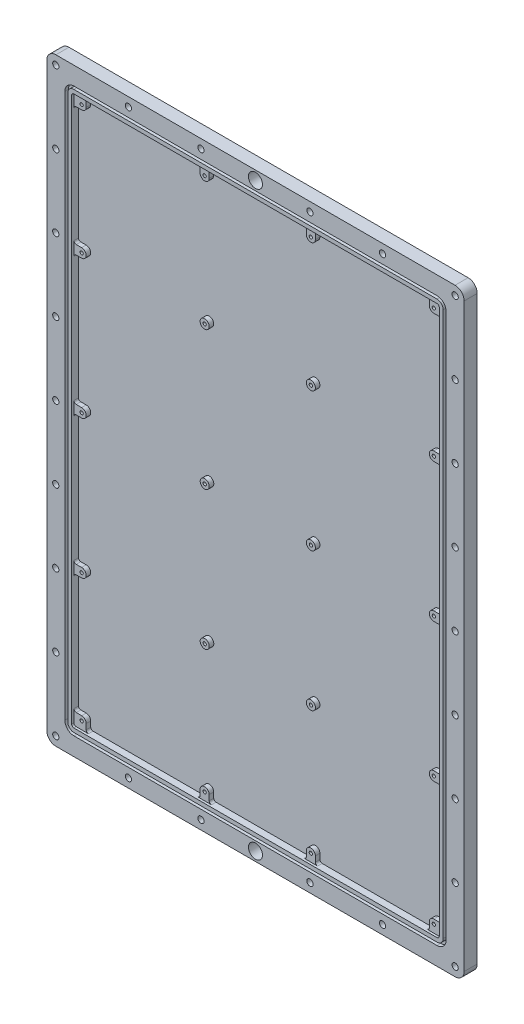
from build123d import *
from OCP.BRepFilletAPI import BRepFilletAPI_MakeChamfer

# Parameters (mm, degrees)
SKETCH1_W           = 291.973
SKETCH1_H           = 418.973
BOSS_EXTRUDE1_DEPTH = 9.144
SKETCH4_R           = 2.1844
CUT_EXTRUDE1_DEPTH  = 511.754559641
CUT_EXTRUDE2_DEPTH  = 2.54
LPATTERN4_COUNT     = 8
LPATTERN4_PITCH     = 50.8
CUT_EXTRUDE3_DEPTH  = 4.7625
SKETCH7_R           = 1.1303
CUT_EXTRUDE4_DEPTH  = 1.5875
FILLET1_R           = 6.35
SKETCH10_R          = 2.1844
SKETCH10_R_2        = 4.9022
CUT_EXTRUDE7_DEPTH  = 511.754559641
LPATTERN5_COUNT     = 2
LPATTERN5_PITCH     = 406.4
CHAMFER1_SIZE       = 2.54
CHAMFER1_SIZE2      = 2.207988314
BOSS_EXTRUDE4_START = 3.175
SKETCH11_R          = 3.175
SKETCH11_R_2        = 1.1303
BOSS_EXTRUDE4_DEPTH = 3.175
FILLET2_R           = 1.5875


with BuildPart() as part:
    # Sketch1 → Boss-Extrude1 (new body)
    with BuildSketch(Plane.XY):
        with Locations((145.9865, 209.4865)):
            Rectangle(SKETCH1_W, SKETCH1_H)
    extrude(amount=BOSS_EXTRUDE1_DEPTH)

    # Sketch4 → Cut-Extrude1 (cut, through all)
    with BuildSketch(Plane.XY.offset(9.144)):
        with Locations((6.2865, 6.2865)):
            Circle(SKETCH4_R)
        with Locations((6.2865, 412.6865)):
            Circle(SKETCH4_R)
        with Locations((285.6865, 412.6865)):
            Circle(SKETCH4_R)
        with Locations((285.6865, 6.2865)):
            Circle(SKETCH4_R)
    cut_extrude1 = extrude(amount=-CUT_EXTRUDE1_DEPTH, mode=Mode.SUBTRACT)

    # Sketch5 → Cut-Extrude2 (cut)
    with BuildSketch(Plane.XY.offset(9.144)):
        with BuildLine():
            Line((18.9865, 406.3365), (272.9865, 406.3365))
            ThreePointArc((272.9865, 406.3365), (277.476628061, 404.476628061), (279.3365, 399.9865))
            Line((279.3365, 399.9865), (279.3365, 18.9865))
            ThreePointArc((279.3365, 18.9865), (277.476628061, 14.496371939), (272.9865, 12.6365))
            Line((272.9865, 12.6365), (18.9865, 12.6365))
            ThreePointArc((18.9865, 12.6365), (14.496371939, 14.496371939), (12.6365, 18.9865))
            Line((12.6365, 18.9865), (12.6365, 399.9865))
            ThreePointArc((12.6365, 399.9865), (14.496371939, 404.476628061), (18.9865, 406.3365))
        make_face()
        with BuildLine():
            ThreePointArc((272.9865, 14.6685), (276.039787081, 15.933212919), (277.3045, 18.9865))
            Line((277.3045, 18.9865), (277.3045, 399.9865))
            ThreePointArc((277.3045, 399.9865), (276.039787081, 403.039787081), (272.9865, 404.3045))
            Line((272.9865, 404.3045), (18.9865, 404.3045))
            ThreePointArc((18.9865, 404.3045), (15.933212919, 403.039787081), (14.6685, 399.9865))
            Line((14.6685, 399.9865), (14.6685, 18.9865))
            ThreePointArc((14.6685, 18.9865), (15.933212919, 15.933212919), (18.9865, 14.6685))
            Line((18.9865, 14.6685), (272.9865, 14.6685))
        make_face(mode=Mode.SUBTRACT)
    extrude(amount=-CUT_EXTRUDE2_DEPTH, mode=Mode.SUBTRACT)

    # LPattern4: Cut-Extrude1 ×8
    with Locations(*[(0, -i * LPATTERN4_PITCH, 0) for i in range(1, LPATTERN4_COUNT)]):
        add(cut_extrude1, mode=Mode.SUBTRACT)

    # Sketch6 → Cut-Extrude3 (cut)
    with BuildSketch(Plane.XY.offset(9.144)):
        with BuildLine():
            Line((274.574, 18.9865), (274.574, 399.9865))
            ThreePointArc((274.574, 399.9865), (274.109032015, 401.109032015), (272.9865, 401.574))
            Line((272.9865, 401.574), (18.9865, 401.574))
            ThreePointArc((18.9865, 401.574), (17.863967985, 401.109032015), (17.399, 399.9865))
            Line((17.399, 399.9865), (17.399, 18.9865))
            ThreePointArc((17.399, 18.9865), (17.863967985, 17.863967985), (18.9865, 17.399))
            Line((18.9865, 17.399), (272.9865, 17.399))
            ThreePointArc((272.9865, 17.399), (274.109032015, 17.863967985), (274.574, 18.9865))
        make_face()
    extrude(amount=-CUT_EXTRUDE3_DEPTH, mode=Mode.SUBTRACT)

    # Sketch7 → Cut-Extrude4 (cut)
    with BuildSketch(Plane.XY.offset(4.3815)):
        with Locations((22.7965, 396.1765)):
            Circle(SKETCH7_R)
        with Locations((269.1765, 396.1765)):
            Circle(SKETCH7_R)
        with Locations((22.7965, 22.7965)):
            Circle(SKETCH7_R)
        with Locations((108.8517, 22.7965)):
            Circle(SKETCH7_R)
        with Locations((108.8517, 396.1765)):
            Circle(SKETCH7_R)
        with Locations((183.1213, 396.1765)):
            Circle(SKETCH7_R)
        with Locations((183.1213, 22.7965)):
            Circle(SKETCH7_R)
        with Locations((269.1765, 22.7965)):
            Circle(SKETCH7_R)
        with Locations((269.1765, 112.6109)):
            Circle(SKETCH7_R)
        with Locations((108.8898, 112.6109)):
            Circle(SKETCH7_R)
        with Locations((183.1594, 112.6109)):
            Circle(SKETCH7_R)
        with Locations((22.7965, 112.6109)):
            Circle(SKETCH7_R)
        with Locations((269.1765, 209.4865)):
            Circle(SKETCH7_R)
        with Locations((108.8898, 209.4865)):
            Circle(SKETCH7_R)
        with Locations((183.1594, 209.4865)):
            Circle(SKETCH7_R)
        with Locations((22.7965, 209.4865)):
            Circle(SKETCH7_R)
        with Locations((269.1765, 306.3621)):
            Circle(SKETCH7_R)
        with Locations((108.8517, 306.3621)):
            Circle(SKETCH7_R)
        with Locations((183.1213, 306.3621)):
            Circle(SKETCH7_R)
        with Locations((22.7965, 306.3621)):
            Circle(SKETCH7_R)
    extrude(amount=-CUT_EXTRUDE4_DEPTH, mode=Mode.SUBTRACT)

    # Fillet1
    fillet1_edges = [part.edges().sort_by_distance(p)[0] for p in [
        (0, 418.973, 4.572),
        (291.973, 418.973, 4.572),
        (291.973, 0, 4.572),
        (0, 0, 4.572),
    ]]
    fillet(fillet1_edges, radius=FILLET1_R)

    # Sketch10 → Cut-Extrude7 (cut, through all)
    with BuildSketch(Plane(origin=(0, 0, 0), x_dir=(-1, 0, 0), z_dir=(0, 0, -1))):
        with Locations((-234.8865, 412.6865)):
            Circle(SKETCH10_R)
        with Locations((-184.0865, 412.6865)):
            Circle(SKETCH10_R)
        with Locations((-107.8865, 412.6865)):
            Circle(SKETCH10_R)
        with Locations((-57.0865, 412.6865)):
            Circle(SKETCH10_R)
        with Locations((-145.9865, 412.6865)):
            Circle(SKETCH10_R_2)
    cut_extrude7 = extrude(amount=-CUT_EXTRUDE7_DEPTH, mode=Mode.SUBTRACT)

    # LPattern5: Cut-Extrude7 ×2
    with Locations(*[(0, -i * LPATTERN5_PITCH, 0) for i in range(1, LPATTERN5_COUNT)]):
        add(cut_extrude7, mode=Mode.SUBTRACT)

    # Chamfer1: one chamfer whose edges measure the first distance from different faces: ONE call of the kernel's chamfer builder (chamfer() names one face for all edges)
    chamfer1_edges_1 = [part.edges().sort_by_distance(p)[0] for p in [
        (4.1021, 6.2865, 0),
    ]]
    chamfer1_side_1 = [part.faces().sort_by_distance(p)[0] for p in [
        (4.1021, 6.2865, 4.572),
    ]]
    chamfer1_edges_2 = [part.edges().sort_by_distance(p)[0] for p in [
        (4.1021, 412.6865, 0),
    ]]
    chamfer1_side_2 = [part.faces().sort_by_distance(p)[0] for p in [
        (4.1021, 412.6865, 4.572),
    ]]
    chamfer1_edges_3 = [part.edges().sort_by_distance(p)[0] for p in [
        (283.5021, 412.6865, 0),
    ]]
    chamfer1_side_3 = [part.faces().sort_by_distance(p)[0] for p in [
        (283.5021, 412.6865, 4.572),
    ]]
    chamfer1_edges_4 = [part.edges().sort_by_distance(p)[0] for p in [
        (237.0709, 412.6865, 0),
        (186.2709, 412.6865, 0),
        (110.0709, 412.6865, 0),
        (59.2709, 412.6865, 0),
        (237.0709, 6.2865, 0),
        (186.2709, 6.2865, 0),
        (110.0709, 6.2865, 0),
        (59.2709, 6.2865, 0),
    ]]
    chamfer1_side_4 = [part.faces().sort_by_distance(p)[0] for p in [
        (145.9865, 209.4865, 0),
    ]]
    chamfer1_edges_5 = [part.edges().sort_by_distance(p)[0] for p in [
        (283.5021, 6.2865, 0),
    ]]
    chamfer1_side_5 = [part.faces().sort_by_distance(p)[0] for p in [
        (283.5021, 6.2865, 4.572),
    ]]
    chamfer1_edges_6 = [part.edges().sort_by_distance(p)[0] for p in [
        (4.1021, 361.8865, 0),
    ]]
    chamfer1_side_6 = [part.faces().sort_by_distance(p)[0] for p in [
        (4.1021, 361.8865, 4.572),
    ]]
    chamfer1_edges_7 = [part.edges().sort_by_distance(p)[0] for p in [
        (283.5021, 361.8865, 0),
    ]]
    chamfer1_side_7 = [part.faces().sort_by_distance(p)[0] for p in [
        (283.5021, 361.8865, 4.572),
    ]]
    chamfer1_edges_8 = [part.edges().sort_by_distance(p)[0] for p in [
        (4.1021, 311.0865, 0),
    ]]
    chamfer1_side_8 = [part.faces().sort_by_distance(p)[0] for p in [
        (4.1021, 311.0865, 4.572),
    ]]
    chamfer1_edges_9 = [part.edges().sort_by_distance(p)[0] for p in [
        (283.5021, 311.0865, 0),
    ]]
    chamfer1_side_9 = [part.faces().sort_by_distance(p)[0] for p in [
        (283.5021, 311.0865, 4.572),
    ]]
    chamfer1_edges_10 = [part.edges().sort_by_distance(p)[0] for p in [
        (4.1021, 260.2865, 0),
    ]]
    chamfer1_side_10 = [part.faces().sort_by_distance(p)[0] for p in [
        (4.1021, 260.2865, 4.572),
    ]]
    chamfer1_edges_11 = [part.edges().sort_by_distance(p)[0] for p in [
        (283.5021, 260.2865, 0),
    ]]
    chamfer1_side_11 = [part.faces().sort_by_distance(p)[0] for p in [
        (283.5021, 260.2865, 4.572),
    ]]
    chamfer1_edges_12 = [part.edges().sort_by_distance(p)[0] for p in [
        (4.1021, 209.4865, 0),
    ]]
    chamfer1_side_12 = [part.faces().sort_by_distance(p)[0] for p in [
        (4.1021, 209.4865, 4.572),
    ]]
    chamfer1_edges_13 = [part.edges().sort_by_distance(p)[0] for p in [
        (283.5021, 209.4865, 0),
    ]]
    chamfer1_side_13 = [part.faces().sort_by_distance(p)[0] for p in [
        (283.5021, 209.4865, 4.572),
    ]]
    chamfer1_edges_14 = [part.edges().sort_by_distance(p)[0] for p in [
        (4.1021, 158.6865, 0),
    ]]
    chamfer1_side_14 = [part.faces().sort_by_distance(p)[0] for p in [
        (4.1021, 158.6865, 4.572),
    ]]
    chamfer1_edges_15 = [part.edges().sort_by_distance(p)[0] for p in [
        (283.5021, 158.6865, 0),
    ]]
    chamfer1_side_15 = [part.faces().sort_by_distance(p)[0] for p in [
        (283.5021, 158.6865, 4.572),
    ]]
    chamfer1_edges_16 = [part.edges().sort_by_distance(p)[0] for p in [
        (4.1021, 107.8865, 0),
    ]]
    chamfer1_side_16 = [part.faces().sort_by_distance(p)[0] for p in [
        (4.1021, 107.8865, 4.572),
    ]]
    chamfer1_edges_17 = [part.edges().sort_by_distance(p)[0] for p in [
        (283.5021, 107.8865, 0),
    ]]
    chamfer1_side_17 = [part.faces().sort_by_distance(p)[0] for p in [
        (283.5021, 107.8865, 4.572),
    ]]
    chamfer1_edges_18 = [part.edges().sort_by_distance(p)[0] for p in [
        (4.1021, 57.0865, 0),
    ]]
    chamfer1_side_18 = [part.faces().sort_by_distance(p)[0] for p in [
        (4.1021, 57.0865, 4.572),
    ]]
    chamfer1_edges_19 = [part.edges().sort_by_distance(p)[0] for p in [
        (283.5021, 57.0865, 0),
    ]]
    chamfer1_side_19 = [part.faces().sort_by_distance(p)[0] for p in [
        (283.5021, 57.0865, 4.572),
    ]]
    chamfer1 = BRepFilletAPI_MakeChamfer(part.part.solid().wrapped)
    for e in chamfer1_edges_1:
        chamfer1.Add(CHAMFER1_SIZE, CHAMFER1_SIZE2, e.wrapped, chamfer1_side_1[0].wrapped)  # the first distance lies on this face
    for e in chamfer1_edges_2:
        chamfer1.Add(CHAMFER1_SIZE, CHAMFER1_SIZE2, e.wrapped, chamfer1_side_2[0].wrapped)  # the first distance lies on this face
    for e in chamfer1_edges_3:
        chamfer1.Add(CHAMFER1_SIZE, CHAMFER1_SIZE2, e.wrapped, chamfer1_side_3[0].wrapped)  # the first distance lies on this face
    for e in chamfer1_edges_4:
        chamfer1.Add(CHAMFER1_SIZE, CHAMFER1_SIZE2, e.wrapped, chamfer1_side_4[0].wrapped)  # the first distance lies on this face
    for e in chamfer1_edges_5:
        chamfer1.Add(CHAMFER1_SIZE, CHAMFER1_SIZE2, e.wrapped, chamfer1_side_5[0].wrapped)  # the first distance lies on this face
    for e in chamfer1_edges_6:
        chamfer1.Add(CHAMFER1_SIZE, CHAMFER1_SIZE2, e.wrapped, chamfer1_side_6[0].wrapped)  # the first distance lies on this face
    for e in chamfer1_edges_7:
        chamfer1.Add(CHAMFER1_SIZE, CHAMFER1_SIZE2, e.wrapped, chamfer1_side_7[0].wrapped)  # the first distance lies on this face
    for e in chamfer1_edges_8:
        chamfer1.Add(CHAMFER1_SIZE, CHAMFER1_SIZE2, e.wrapped, chamfer1_side_8[0].wrapped)  # the first distance lies on this face
    for e in chamfer1_edges_9:
        chamfer1.Add(CHAMFER1_SIZE, CHAMFER1_SIZE2, e.wrapped, chamfer1_side_9[0].wrapped)  # the first distance lies on this face
    for e in chamfer1_edges_10:
        chamfer1.Add(CHAMFER1_SIZE, CHAMFER1_SIZE2, e.wrapped, chamfer1_side_10[0].wrapped)  # the first distance lies on this face
    for e in chamfer1_edges_11:
        chamfer1.Add(CHAMFER1_SIZE, CHAMFER1_SIZE2, e.wrapped, chamfer1_side_11[0].wrapped)  # the first distance lies on this face
    for e in chamfer1_edges_12:
        chamfer1.Add(CHAMFER1_SIZE, CHAMFER1_SIZE2, e.wrapped, chamfer1_side_12[0].wrapped)  # the first distance lies on this face
    for e in chamfer1_edges_13:
        chamfer1.Add(CHAMFER1_SIZE, CHAMFER1_SIZE2, e.wrapped, chamfer1_side_13[0].wrapped)  # the first distance lies on this face
    for e in chamfer1_edges_14:
        chamfer1.Add(CHAMFER1_SIZE, CHAMFER1_SIZE2, e.wrapped, chamfer1_side_14[0].wrapped)  # the first distance lies on this face
    for e in chamfer1_edges_15:
        chamfer1.Add(CHAMFER1_SIZE, CHAMFER1_SIZE2, e.wrapped, chamfer1_side_15[0].wrapped)  # the first distance lies on this face
    for e in chamfer1_edges_16:
        chamfer1.Add(CHAMFER1_SIZE, CHAMFER1_SIZE2, e.wrapped, chamfer1_side_16[0].wrapped)  # the first distance lies on this face
    for e in chamfer1_edges_17:
        chamfer1.Add(CHAMFER1_SIZE, CHAMFER1_SIZE2, e.wrapped, chamfer1_side_17[0].wrapped)  # the first distance lies on this face
    for e in chamfer1_edges_18:
        chamfer1.Add(CHAMFER1_SIZE, CHAMFER1_SIZE2, e.wrapped, chamfer1_side_18[0].wrapped)  # the first distance lies on this face
    for e in chamfer1_edges_19:
        chamfer1.Add(CHAMFER1_SIZE, CHAMFER1_SIZE2, e.wrapped, chamfer1_side_19[0].wrapped)  # the first distance lies on this face
    add(Compound.cast(chamfer1.Shape()), mode=Mode.REPLACE)

    # Sketch11 → Boss-Extrude4 (add)
    # profile 1 of 34: a face of its own
    with BuildSketch(Plane.XY.offset(4.3815).offset(BOSS_EXTRUDE4_START)):
        with BuildLine():
            Line((17.399, 399.9865), (17.399, 393.0015))
            Line((17.399, 393.0015), (22.7965, 393.0015))
            ThreePointArc((22.7965, 393.0015), (20.55143597, 398.42156403), (25.9715, 396.1765))
            Line((25.9715, 396.1765), (25.9715, 401.574))
            Line((25.9715, 401.574), (18.9865, 401.574))
            ThreePointArc((18.9865, 401.574), (17.863967985, 401.109032015), (17.399, 399.9865))
        make_face()
    # profile 2 of 34: a face of its own
    with BuildSketch(Plane.XY.offset(4.3815).offset(BOSS_EXTRUDE4_START)):
        with Locations((22.7965, 396.1765)):
            Circle(SKETCH11_R)
        with Locations((22.7965, 396.1765)):
            Circle(SKETCH11_R_2, mode=Mode.SUBTRACT)
    # profile 3 of 34: a face of its own
    with BuildSketch(Plane.XY.offset(4.3815).offset(BOSS_EXTRUDE4_START)):
        with Locations((108.8517, 396.1765)):
            Circle(SKETCH11_R)
        with Locations((108.8517, 396.1765)):
            Circle(SKETCH11_R_2, mode=Mode.SUBTRACT)
    # profile 4 of 34: a face of its own
    with BuildSketch(Plane.XY.offset(4.3815).offset(BOSS_EXTRUDE4_START)):
        with BuildLine():
            Line((112.0267, 401.574), (105.6767, 401.574))
            Line((105.6767, 401.574), (105.6767, 396.1765))
            ThreePointArc((105.6767, 396.1765), (108.8517, 399.3515), (112.0267, 396.1765))
            Line((112.0267, 396.1765), (112.0267, 401.574))
        make_face()
    # profile 5 of 34: a face of its own
    with BuildSketch(Plane.XY.offset(4.3815).offset(BOSS_EXTRUDE4_START)):
        with Locations((183.1213, 396.1765)):
            Circle(SKETCH11_R)
        with Locations((183.1213, 396.1765)):
            Circle(SKETCH11_R_2, mode=Mode.SUBTRACT)
    # profile 6 of 34: a face of its own
    with BuildSketch(Plane.XY.offset(4.3815).offset(BOSS_EXTRUDE4_START)):
        with BuildLine():
            Line((186.2963, 401.574), (179.9463, 401.574))
            Line((179.9463, 401.574), (179.9463, 396.1765))
            ThreePointArc((179.9463, 396.1765), (183.1213, 399.3515), (186.2963, 396.1765))
            Line((186.2963, 396.1765), (186.2963, 401.574))
        make_face()
    # profile 7 of 34: a face of its own
    with BuildSketch(Plane.XY.offset(4.3815).offset(BOSS_EXTRUDE4_START)):
        with Locations((269.1765, 396.1765)):
            Circle(SKETCH11_R)
        with Locations((269.1765, 396.1765)):
            Circle(SKETCH11_R_2, mode=Mode.SUBTRACT)
    # profile 8 of 34: a face of its own
    with BuildSketch(Plane.XY.offset(4.3815).offset(BOSS_EXTRUDE4_START)):
        with BuildLine():
            Line((272.9865, 401.574), (266.0015, 401.574))
            Line((266.0015, 401.574), (266.0015, 396.1765))
            ThreePointArc((266.0015, 396.1765), (269.1765, 399.3515), (272.3515, 396.1765))
            ThreePointArc((272.3515, 396.1765), (271.42156403, 393.93143597), (269.1765, 393.0015))
            Line((269.1765, 393.0015), (274.574, 393.0015))
            Line((274.574, 393.0015), (274.574, 399.9865))
            ThreePointArc((274.574, 399.9865), (274.109032015, 401.109032015), (272.9865, 401.574))
        make_face()
    # profile 9 of 34: a face of its own
    with BuildSketch(Plane.XY.offset(4.3815).offset(BOSS_EXTRUDE4_START)):
        with Locations((269.1765, 306.3621)):
            Circle(SKETCH11_R)
        with Locations((269.1765, 306.3621)):
            Circle(SKETCH11_R_2, mode=Mode.SUBTRACT)
    # profile 10 of 34: a face of its own
    with BuildSketch(Plane.XY.offset(4.3815).offset(BOSS_EXTRUDE4_START)):
        with BuildLine():
            Line((269.1765, 303.1871), (274.574, 303.1871))
            Line((274.574, 303.1871), (274.574, 309.5371))
            Line((274.574, 309.5371), (269.1765, 309.5371))
            ThreePointArc((269.1765, 309.5371), (271.42156403, 308.60716403), (272.3515, 306.3621))
            ThreePointArc((272.3515, 306.3621), (271.42156403, 304.11703597), (269.1765, 303.1871))
        make_face()
    # profile 11 of 34: a face of its own
    with BuildSketch(Plane.XY.offset(4.3815).offset(BOSS_EXTRUDE4_START)):
        with Locations((269.1765, 209.4865)):
            Circle(SKETCH11_R)
        with Locations((269.1765, 209.4865)):
            Circle(SKETCH11_R_2, mode=Mode.SUBTRACT)
    # profile 12 of 34: a face of its own
    with BuildSketch(Plane.XY.offset(4.3815).offset(BOSS_EXTRUDE4_START)):
        with BuildLine():
            Line((269.1765, 206.3115), (274.574, 206.3115))
            Line((274.574, 206.3115), (274.574, 212.6615))
            Line((274.574, 212.6615), (269.1765, 212.6615))
            ThreePointArc((269.1765, 212.6615), (271.42156403, 211.73156403), (272.3515, 209.4865))
            ThreePointArc((272.3515, 209.4865), (271.42156403, 207.24143597), (269.1765, 206.3115))
        make_face()
    # profile 13 of 34: a face of its own
    with BuildSketch(Plane.XY.offset(4.3815).offset(BOSS_EXTRUDE4_START)):
        with Locations((269.1765, 112.6109)):
            Circle(SKETCH11_R)
        with Locations((269.1765, 112.6109)):
            Circle(SKETCH11_R_2, mode=Mode.SUBTRACT)
    # profile 14 of 34: a face of its own
    with BuildSketch(Plane.XY.offset(4.3815).offset(BOSS_EXTRUDE4_START)):
        with BuildLine():
            Line((269.1765, 109.4359), (274.574, 109.4359))
            Line((274.574, 109.4359), (274.574, 115.7859))
            Line((274.574, 115.7859), (269.1765, 115.7859))
            ThreePointArc((269.1765, 115.7859), (271.42156403, 114.85596403), (272.3515, 112.6109))
            ThreePointArc((272.3515, 112.6109), (271.42156403, 110.36583597), (269.1765, 109.4359))
        make_face()
    # profile 15 of 34: a face of its own
    with BuildSketch(Plane.XY.offset(4.3815).offset(BOSS_EXTRUDE4_START)):
        with Locations((269.1765, 22.7965)):
            Circle(SKETCH11_R)
        with Locations((269.1765, 22.7965)):
            Circle(SKETCH11_R_2, mode=Mode.SUBTRACT)
    # profile 16 of 34: a face of its own
    with BuildSketch(Plane.XY.offset(4.3815).offset(BOSS_EXTRUDE4_START)):
        with BuildLine():
            Line((266.0015, 22.7965), (266.0015, 17.399))
            Line((266.0015, 17.399), (272.9865, 17.399))
            ThreePointArc((272.9865, 17.399), (274.109032015, 17.863967985), (274.574, 18.9865))
            Line((274.574, 18.9865), (274.574, 25.9715))
            Line((274.574, 25.9715), (269.1765, 25.9715))
            ThreePointArc((269.1765, 25.9715), (271.42156403, 25.04156403), (272.3515, 22.7965))
            ThreePointArc((272.3515, 22.7965), (269.1765, 19.6215), (266.0015, 22.7965))
        make_face()
    # profile 17 of 34: a face of its own
    with BuildSketch(Plane.XY.offset(4.3815).offset(BOSS_EXTRUDE4_START)):
        with Locations((183.1213, 22.7965)):
            Circle(SKETCH11_R)
        with Locations((183.1213, 22.7965)):
            Circle(SKETCH11_R_2, mode=Mode.SUBTRACT)
    # profile 18 of 34: a face of its own
    with BuildSketch(Plane.XY.offset(4.3815).offset(BOSS_EXTRUDE4_START)):
        with BuildLine():
            Line((179.9463, 22.7965), (179.9463, 17.399))
            Line((179.9463, 17.399), (186.2963, 17.399))
            Line((186.2963, 17.399), (186.2963, 22.7965))
            ThreePointArc((186.2963, 22.7965), (183.1213, 19.6215), (179.9463, 22.7965))
        make_face()
    # profile 19 of 34: a face of its own
    with BuildSketch(Plane.XY.offset(4.3815).offset(BOSS_EXTRUDE4_START)):
        with Locations((108.8517, 22.7965)):
            Circle(SKETCH11_R)
        with Locations((108.8517, 22.7965)):
            Circle(SKETCH11_R_2, mode=Mode.SUBTRACT)
    # profile 20 of 34: a face of its own
    with BuildSketch(Plane.XY.offset(4.3815).offset(BOSS_EXTRUDE4_START)):
        with BuildLine():
            Line((105.6767, 22.7965), (105.6767, 17.399))
            Line((105.6767, 17.399), (112.0267, 17.399))
            Line((112.0267, 17.399), (112.0267, 22.7965))
            ThreePointArc((112.0267, 22.7965), (108.8517, 19.6215), (105.6767, 22.7965))
        make_face()
    # profile 21 of 34: a face of its own
    with BuildSketch(Plane.XY.offset(4.3815).offset(BOSS_EXTRUDE4_START)):
        with Locations((22.7965, 22.7965)):
            Circle(SKETCH11_R)
        with Locations((22.7965, 22.7965)):
            Circle(SKETCH11_R_2, mode=Mode.SUBTRACT)
    # profile 22 of 34: a face of its own
    with BuildSketch(Plane.XY.offset(4.3815).offset(BOSS_EXTRUDE4_START)):
        with BuildLine():
            Line((22.7965, 25.9715), (17.399, 25.9715))
            Line((17.399, 25.9715), (17.399, 18.9865))
            ThreePointArc((17.399, 18.9865), (17.863967985, 17.863967985), (18.9865, 17.399))
            Line((18.9865, 17.399), (25.9715, 17.399))
            Line((25.9715, 17.399), (25.9715, 22.7965))
            ThreePointArc((25.9715, 22.7965), (20.55143597, 20.55143597), (22.7965, 25.9715))
        make_face()
    # profile 23 of 34: a face of its own
    with BuildSketch(Plane.XY.offset(4.3815).offset(BOSS_EXTRUDE4_START)):
        with Locations((22.7965, 112.6109)):
            Circle(SKETCH11_R)
        with Locations((22.7965, 112.6109)):
            Circle(SKETCH11_R_2, mode=Mode.SUBTRACT)
    # profile 24 of 34: a face of its own
    with BuildSketch(Plane.XY.offset(4.3815).offset(BOSS_EXTRUDE4_START)):
        with BuildLine():
            Line((17.399, 109.4359), (22.7965, 109.4359))
            ThreePointArc((22.7965, 109.4359), (19.6215, 112.6109), (22.7965, 115.7859))
            Line((22.7965, 115.7859), (17.399, 115.7859))
            Line((17.399, 115.7859), (17.399, 109.4359))
        make_face()
    # profile 25 of 34: a face of its own
    with BuildSketch(Plane.XY.offset(4.3815).offset(BOSS_EXTRUDE4_START)):
        with Locations((22.7965, 209.4865)):
            Circle(SKETCH11_R)
        with Locations((22.7965, 209.4865)):
            Circle(SKETCH11_R_2, mode=Mode.SUBTRACT)
    # profile 26 of 34: a face of its own
    with BuildSketch(Plane.XY.offset(4.3815).offset(BOSS_EXTRUDE4_START)):
        with BuildLine():
            Line((17.399, 212.6615), (17.399, 206.3115))
            Line((17.399, 206.3115), (22.7965, 206.3115))
            ThreePointArc((22.7965, 206.3115), (19.6215, 209.4865), (22.7965, 212.6615))
            Line((22.7965, 212.6615), (17.399, 212.6615))
        make_face()
    # profile 27 of 34: a face of its own
    with BuildSketch(Plane.XY.offset(4.3815).offset(BOSS_EXTRUDE4_START)):
        with Locations((22.7965, 306.3621)):
            Circle(SKETCH11_R)
        with Locations((22.7965, 306.3621)):
            Circle(SKETCH11_R_2, mode=Mode.SUBTRACT)
    # profile 28 of 34: a face of its own
    with BuildSketch(Plane.XY.offset(4.3815).offset(BOSS_EXTRUDE4_START)):
        with BuildLine():
            Line((17.399, 309.5371), (17.399, 303.1871))
            Line((17.399, 303.1871), (22.7965, 303.1871))
            ThreePointArc((22.7965, 303.1871), (19.6215, 306.3621), (22.7965, 309.5371))
            Line((22.7965, 309.5371), (17.399, 309.5371))
        make_face()
    # profile 29 of 34: a face of its own
    with BuildSketch(Plane.XY.offset(4.3815).offset(BOSS_EXTRUDE4_START)):
        with Locations((108.8517, 306.3621)):
            Circle(SKETCH11_R)
        with Locations((108.8517, 306.3621)):
            Circle(SKETCH11_R_2, mode=Mode.SUBTRACT)
    # profile 30 of 34: a face of its own
    with BuildSketch(Plane.XY.offset(4.3815).offset(BOSS_EXTRUDE4_START)):
        with Locations((183.1213, 306.3621)):
            Circle(SKETCH11_R)
        with Locations((183.1213, 306.3621)):
            Circle(SKETCH11_R_2, mode=Mode.SUBTRACT)
    # profile 31 of 34: a face of its own
    with BuildSketch(Plane.XY.offset(4.3815).offset(BOSS_EXTRUDE4_START)):
        with Locations((183.1594, 209.4865)):
            Circle(SKETCH11_R)
        with Locations((183.1594, 209.4865)):
            Circle(SKETCH11_R_2, mode=Mode.SUBTRACT)
    # profile 32 of 34: a face of its own
    with BuildSketch(Plane.XY.offset(4.3815).offset(BOSS_EXTRUDE4_START)):
        with Locations((108.8898, 209.4865)):
            Circle(SKETCH11_R)
        with Locations((108.8898, 209.4865)):
            Circle(SKETCH11_R_2, mode=Mode.SUBTRACT)
    # profile 33 of 34: a face of its own
    with BuildSketch(Plane.XY.offset(4.3815).offset(BOSS_EXTRUDE4_START)):
        with Locations((108.8898, 112.6109)):
            Circle(SKETCH11_R)
        with Locations((108.8898, 112.6109)):
            Circle(SKETCH11_R_2, mode=Mode.SUBTRACT)
    # profile 34 of 34: a face of its own
    with BuildSketch(Plane.XY.offset(4.3815).offset(BOSS_EXTRUDE4_START)):
        with Locations((183.1594, 112.6109)):
            Circle(SKETCH11_R)
        with Locations((183.1594, 112.6109)):
            Circle(SKETCH11_R_2, mode=Mode.SUBTRACT)
    extrude(amount=-BOSS_EXTRUDE4_DEPTH)

    # Fillet2
    fillet2_edges = [part.edges().sort_by_distance(p)[0] for p in [
        (17.399, 393.0015, 5.969),
        (25.9715, 401.574, 5.969),
        (112.0267, 401.574, 5.969),
        (105.6767, 401.574, 5.969),
        (186.2963, 401.574, 5.969),
        (179.9463, 401.574, 5.969),
        (266.0015, 401.574, 5.969),
        (274.574, 393.0015, 5.969),
        (274.574, 309.5371, 5.969),
        (274.574, 303.1871, 5.969),
        (274.574, 212.6615, 5.969),
        (274.574, 206.3115, 5.969),
        (274.574, 115.7859, 5.969),
        (274.574, 109.4359, 5.969),
        (274.574, 25.9715, 5.969),
        (266.0015, 17.399, 5.969),
        (179.9463, 17.399, 5.969),
        (186.2963, 17.399, 5.969),
        (105.6767, 17.399, 5.969),
        (112.0267, 17.399, 5.969),
        (17.399, 25.9715, 5.969),
        (25.9715, 17.399, 5.969),
        (17.399, 115.7859, 5.969),
        (17.399, 109.4359, 5.969),
        (17.399, 212.6615, 5.969),
        (17.399, 206.3115, 5.969),
        (17.399, 309.5371, 5.969),
        (17.399, 303.1871, 5.969),
    ]]
    fillet(fillet2_edges, radius=FILLET2_R)


solid = part.part
